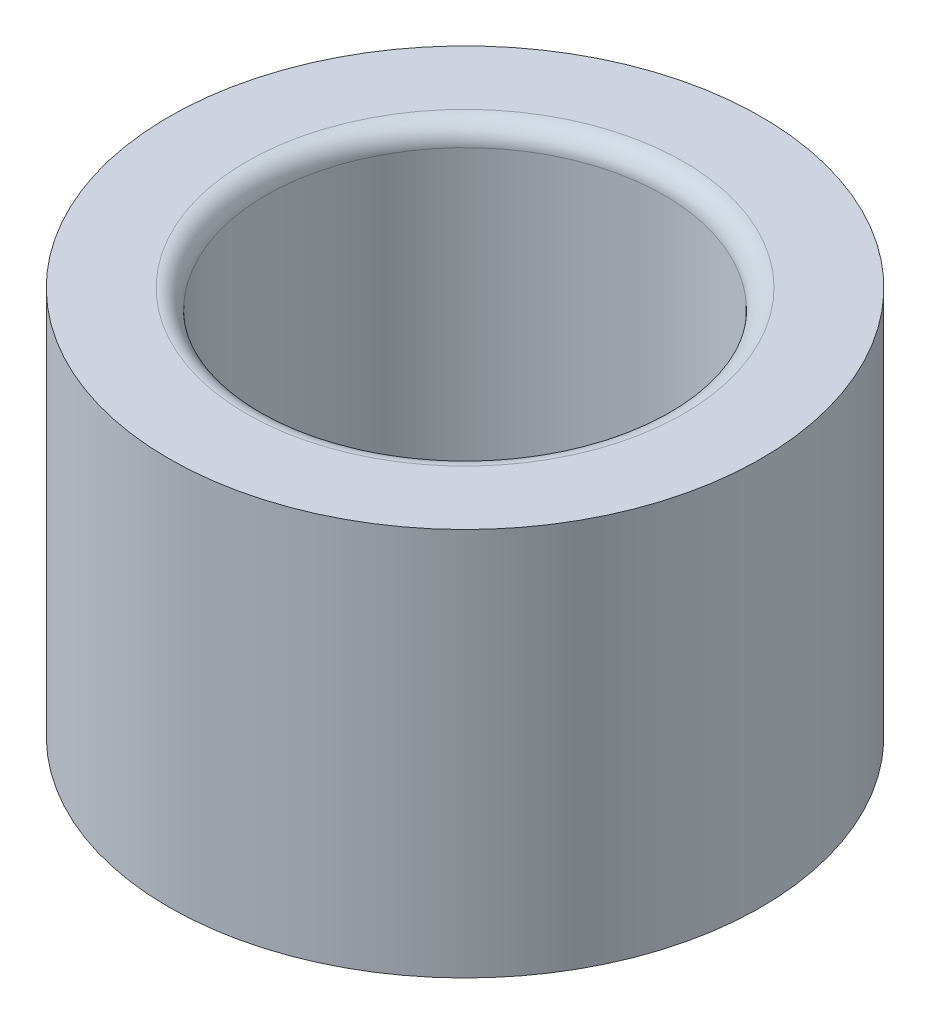
from build123d import *

# Parameters (mm, degrees)
SKETCH1_R           = 15.25
SKETCH1_R_2         = 10.25
BOSS_EXTRUDE1_DEPTH = 20
FILLET1_R           = 1


with BuildPart() as part:
    # Sketch1 → Boss-Extrude1 (new body)
    with BuildSketch(Plane(origin=(0, 0, 0), x_dir=(1, 0, 0), z_dir=(0, 1, 0))):
        with Locations(Location((0, 0, 0), (0, 0, 270))):
            Circle(SKETCH1_R)
        with Locations(Location((0, 0, 0), (0, 0, 270))):
            Circle(SKETCH1_R_2, mode=Mode.SUBTRACT)
    extrude(amount=BOSS_EXTRUDE1_DEPTH)

    # Fillet1
    fillet1_edges = [part.edges().sort_by_distance(p)[0] for p in [
        (0, 20, -10.25),
    ]]
    fillet(fillet1_edges, radius=FILLET1_R)


solid = part.part
